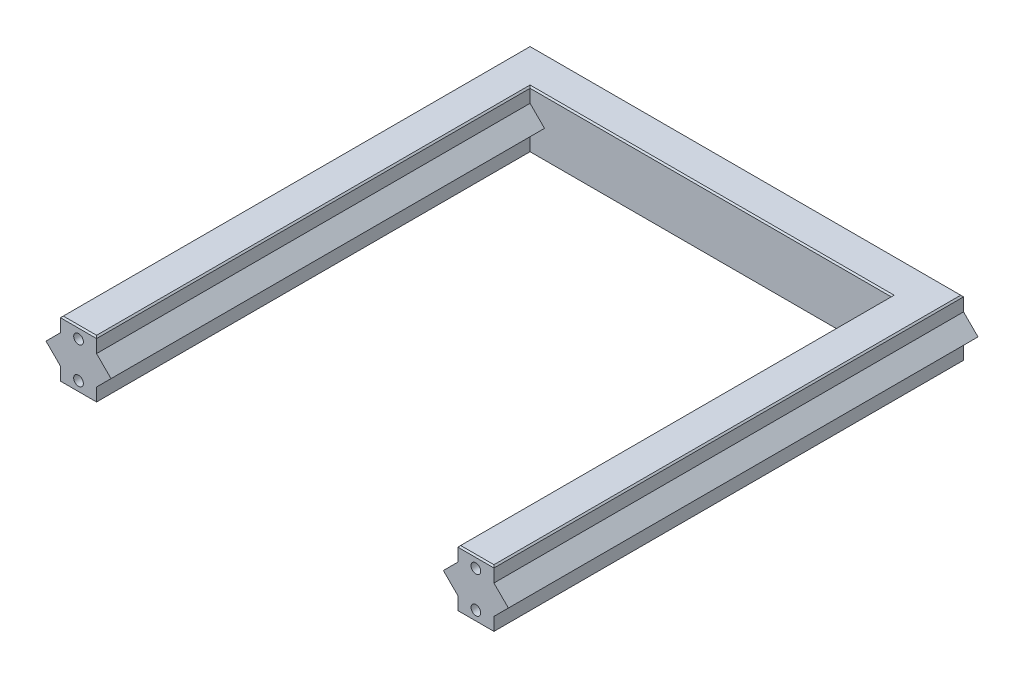
from build123d import *

# Parameters (mm, degrees)
BOSS_EXTRUDE1_DEPTH   = 12.7
BOSS_EXTRUDE2_DEPTH   = 152.4
F_6_32_TAPPED_HOLE1_D = 3.400000058
CHAMFER1_SIZE         = 0.5


with BuildPart() as part:
    # Sketch2 → Boss-Extrude1 (new body)
    with BuildSketch(Plane.XY):
        Polygon((-76.2, 5.08), (-81.28, 0), (-76.2, -5.08), (-76.2, -10.16), (76.2, -10.16), (76.2, -5.08), (81.28, 0), (76.2, 5.08), (76.2, 10.16), (-76.2, 10.16), align=None)
    extrude(amount=BOSS_EXTRUDE1_DEPTH)

    # Sketch3 → Boss-Extrude2 (add)
    with BuildSketch(Plane.XY.offset(12.7)):
        Polygon((-76.2, 10.16), (-63.5, 10.16), (-63.5, 5.08), (-58.42, 0), (-63.5, -5.08), (-63.5, -10.16), (-76.2, -10.16), (-76.2, -5.08), (-81.28, 0), (-76.2, 5.08), align=None)
        Polygon((63.5, 10.16), (63.5, 5.08), (58.42, 0), (63.5, -5.08), (63.5, -10.16), (76.2, -10.16), (76.2, -5.08), (81.28, 0), (76.2, 5.08), (76.2, 10.16), align=None)
    extrude(amount=BOSS_EXTRUDE2_DEPTH)

    # #6-32 Tapped Hole1 (through all)
    with Locations(Plane.XY.offset(165.1)):
        with Locations((-69.85, 6.35), (-69.85, -6.35), (69.85, 6.35), (69.85, -6.35)):
            Hole(F_6_32_TAPPED_HOLE1_D / 2)

    # Chamfer1
    chamfer1_edges = [part.edges().sort_by_distance(p)[0] for p in [
        (0, -10.16, 0),
        (0, 10.16, 0),
        (76.2, -10.16, 82.55),
        (-76.2, -10.16, 82.55),
        (-76.2, 10.16, 82.55),
        (76.2, 10.16, 82.55),
        (0, -10.16, 12.7),
        (-63.5, -10.16, 88.9),
        (-63.5, 10.16, 88.9),
        (-69.85, -10.16, 165.1),
        (-69.85, 10.16, 165.1),
        (0, 10.16, 12.7),
        (63.5, 10.16, 88.9),
        (63.5, -10.16, 88.9),
        (69.85, 10.16, 165.1),
        (69.85, -10.16, 165.1),
    ]]
    chamfer(chamfer1_edges, length=CHAMFER1_SIZE)


solid = part.part
